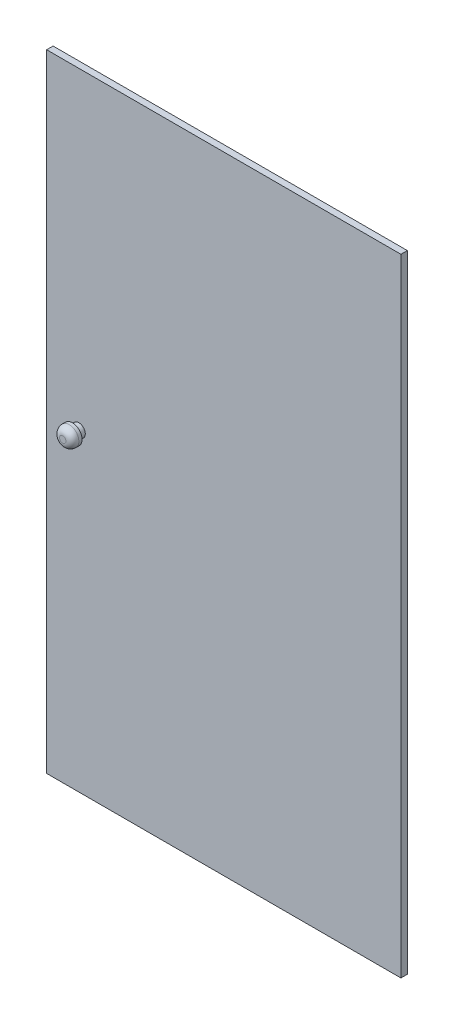
from build123d import *

# Parameters (mm, degrees)
SKETCH2_W           = 550
SKETCH2_H           = 973
BOSS_EXTRUDE1_DEPTH = 10
SKETCH3_R           = 10
BOSS_EXTRUDE2_DEPTH = 10
SKETCH4_R           = 15
BOSS_EXTRUDE3_DEPTH = 15
FILLET1_R           = 10


with BuildPart() as part:
    # Sketch2 → Boss-Extrude1 (new body)
    with BuildSketch(Plane.XY):
        Rectangle(SKETCH2_W, SKETCH2_H)
    extrude(amount=BOSS_EXTRUDE1_DEPTH)

    # Sketch3 → Boss-Extrude2 (add)
    with BuildSketch(Plane.XY.offset(10)):
        with Locations((-225, 0)):
            Circle(SKETCH3_R)
    extrude(amount=BOSS_EXTRUDE2_DEPTH)

    # Sketch4 → Boss-Extrude3 (add)
    with BuildSketch(Plane.XY.offset(20)):
        with Locations((-225, 0)):
            Circle(SKETCH4_R)
    extrude(amount=BOSS_EXTRUDE3_DEPTH)

    # Fillet1
    fillet1_edges = [part.edges().sort_by_distance(p)[0] for p in [
        (-240, 0, 35),
    ]]
    fillet(fillet1_edges, radius=FILLET1_R)


solid = part.part
